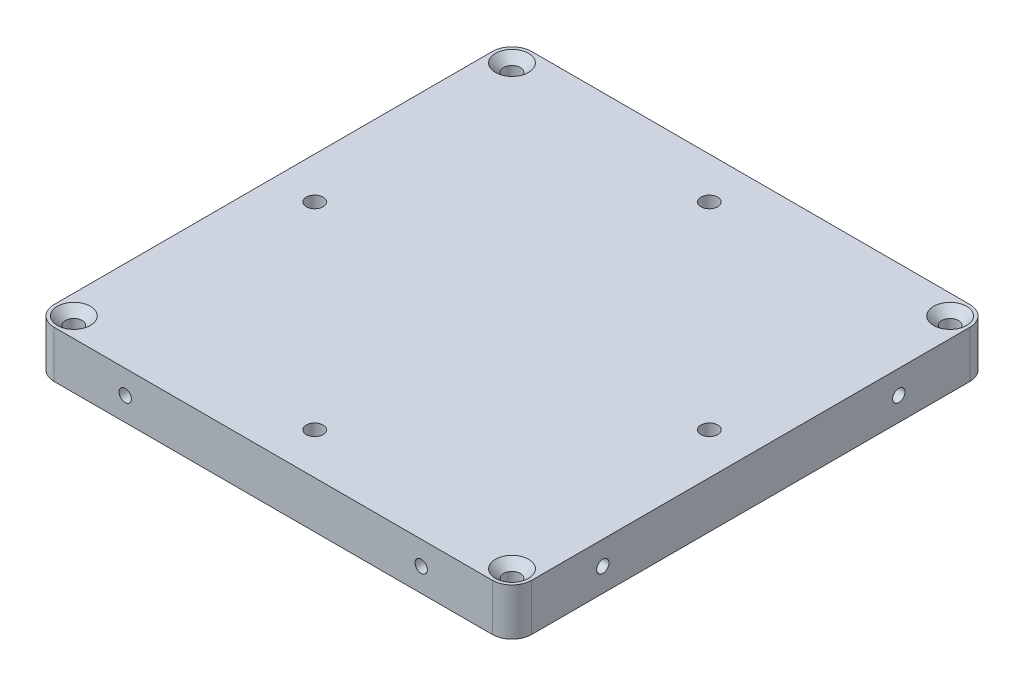
from build123d import *

# Parameters (mm, degrees)
SKETCH1_W                     = 96.825
SKETCH1_H                     = 96.825
BOSS_EXTRUDE1_DEPTH           = 4.7625
FILLET1_R                     = 4
CSK_FOR_M3_SFHCS2_D           = 3.4
CSK_FOR_M3_SFHCS2_CSINK_D     = 6.72
CSK_FOR_M3_SFHCS2_CSINK_ANGLE = 90
CSK_FOR_M3_SFHCS1_D           = 3.4
CSK_FOR_M3_SFHCS1_DEPTH       = 35
CSK_FOR_M3_SFHCS1_CSINK_D     = 6.72
CSK_FOR_M3_SFHCS1_CSINK_ANGLE = 90
CSK_FOR_M3_SFHCS1_TIP         = 1.021463052
M3X0_5_TAPPED_HOLE1_D         = 2.5
M3X0_5_TAPPED_HOLE1_DEPTH     = 10
M3X0_5_TAPPED_HOLE1_TIP       = 0.751075774
M3X0_5_TAPPED_HOLE2_D         = 2.5
M3X0_5_TAPPED_HOLE2_DEPTH     = 10
M3X0_5_TAPPED_HOLE2_TIP       = 0.751075774
M3X0_5_TAPPED_HOLE3_D         = 2.5
M3X0_5_TAPPED_HOLE3_DEPTH     = 10
M3X0_5_TAPPED_HOLE3_TIP       = 0.751075774
M3X0_5_TAPPED_HOLE4_D         = 2.5
M3X0_5_TAPPED_HOLE4_DEPTH     = 10
M3X0_5_TAPPED_HOLE4_TIP       = 0.751075774


with BuildPart() as part:
    # Sketch1 → Boss-Extrude1 (new, symmetric)
    with BuildSketch(Plane(origin=(0, 0, 0), x_dir=(1, 0, 0), z_dir=(0, 1, 0))):
        Rectangle(SKETCH1_W, SKETCH1_H)
    extrude(amount=BOSS_EXTRUDE1_DEPTH, both=True)

    # Fillet1
    fillet1_edges = [part.edges().sort_by_distance(p)[0] for p in [
        (-48.4125, 0, -48.4125),
        (48.4125, 0, -48.4125),
        (48.4125, 0, 48.4125),
        (-48.4125, 0, 48.4125),
    ]]
    fillet(fillet1_edges, radius=FILLET1_R)

    # CSK for M3 SFHCS2 (through all)
    with Locations(Plane.XZ.offset(4.7625)):
        with Locations((-40, 0), (0, -40), (40, 0), (0, 40)):
            CounterSinkHole(CSK_FOR_M3_SFHCS2_D / 2, CSK_FOR_M3_SFHCS2_CSINK_D / 2, counter_sink_angle=CSK_FOR_M3_SFHCS2_CSINK_ANGLE)

    # CSK for M3 SFHCS1
    with Locations(Plane(origin=(0, 4.7625, 0), x_dir=(1, 0, 0), z_dir=(0, 1, 0))):
        with Locations((-44.4125, 44.4125), (44.4125, 44.4125), (44.4125, -44.4125), (-44.4125, -44.4125)):
            CounterSinkHole(CSK_FOR_M3_SFHCS1_D / 2, CSK_FOR_M3_SFHCS1_CSINK_D / 2, depth=CSK_FOR_M3_SFHCS1_DEPTH, counter_sink_angle=CSK_FOR_M3_SFHCS1_CSINK_ANGLE)
            with Locations((0, 0, -(CSK_FOR_M3_SFHCS1_DEPTH + CSK_FOR_M3_SFHCS1_TIP / 2))):  # 118° drill point
                Cone(0, CSK_FOR_M3_SFHCS1_D / 2, CSK_FOR_M3_SFHCS1_TIP, mode=Mode.SUBTRACT)

    # M3x0.5 Tapped Hole1
    with Locations(Plane.XY.offset(48.4125)):
        with Locations((-30, 0), (30, 0)):
            Hole(M3X0_5_TAPPED_HOLE1_D / 2, depth=M3X0_5_TAPPED_HOLE1_DEPTH)
            with Locations((0, 0, -(M3X0_5_TAPPED_HOLE1_DEPTH + M3X0_5_TAPPED_HOLE1_TIP / 2))):  # 118° drill point
                Cone(0, M3X0_5_TAPPED_HOLE1_D / 2, M3X0_5_TAPPED_HOLE1_TIP, mode=Mode.SUBTRACT)

    # M3x0.5 Tapped Hole2
    with Locations(Plane.ZY.offset(48.4125)):
        with Locations((-30, 0), (30, 0)):
            Hole(M3X0_5_TAPPED_HOLE2_D / 2, depth=M3X0_5_TAPPED_HOLE2_DEPTH)
            with Locations((0, 0, -(M3X0_5_TAPPED_HOLE2_DEPTH + M3X0_5_TAPPED_HOLE2_TIP / 2))):  # 118° drill point
                Cone(0, M3X0_5_TAPPED_HOLE2_D / 2, M3X0_5_TAPPED_HOLE2_TIP, mode=Mode.SUBTRACT)

    # M3x0.5 Tapped Hole3
    with Locations(Plane(origin=(0, 0, -48.4125), x_dir=(-1, 0, 0), z_dir=(0, 0, -1))):
        with Locations((-30, 0), (30, 0)):
            Hole(M3X0_5_TAPPED_HOLE3_D / 2, depth=M3X0_5_TAPPED_HOLE3_DEPTH)
            with Locations((0, 0, -(M3X0_5_TAPPED_HOLE3_DEPTH + M3X0_5_TAPPED_HOLE3_TIP / 2))):  # 118° drill point
                Cone(0, M3X0_5_TAPPED_HOLE3_D / 2, M3X0_5_TAPPED_HOLE3_TIP, mode=Mode.SUBTRACT)

    # M3x0.5 Tapped Hole4
    with Locations(Plane(origin=(48.4125, 0, 0), x_dir=(0, 0, -1), z_dir=(1, 0, 0))):
        with Locations((-30, 0), (30, 0)):
            Hole(M3X0_5_TAPPED_HOLE4_D / 2, depth=M3X0_5_TAPPED_HOLE4_DEPTH)
            with Locations((0, 0, -(M3X0_5_TAPPED_HOLE4_DEPTH + M3X0_5_TAPPED_HOLE4_TIP / 2))):  # 118° drill point
                Cone(0, M3X0_5_TAPPED_HOLE4_D / 2, M3X0_5_TAPPED_HOLE4_TIP, mode=Mode.SUBTRACT)


solid = part.part
